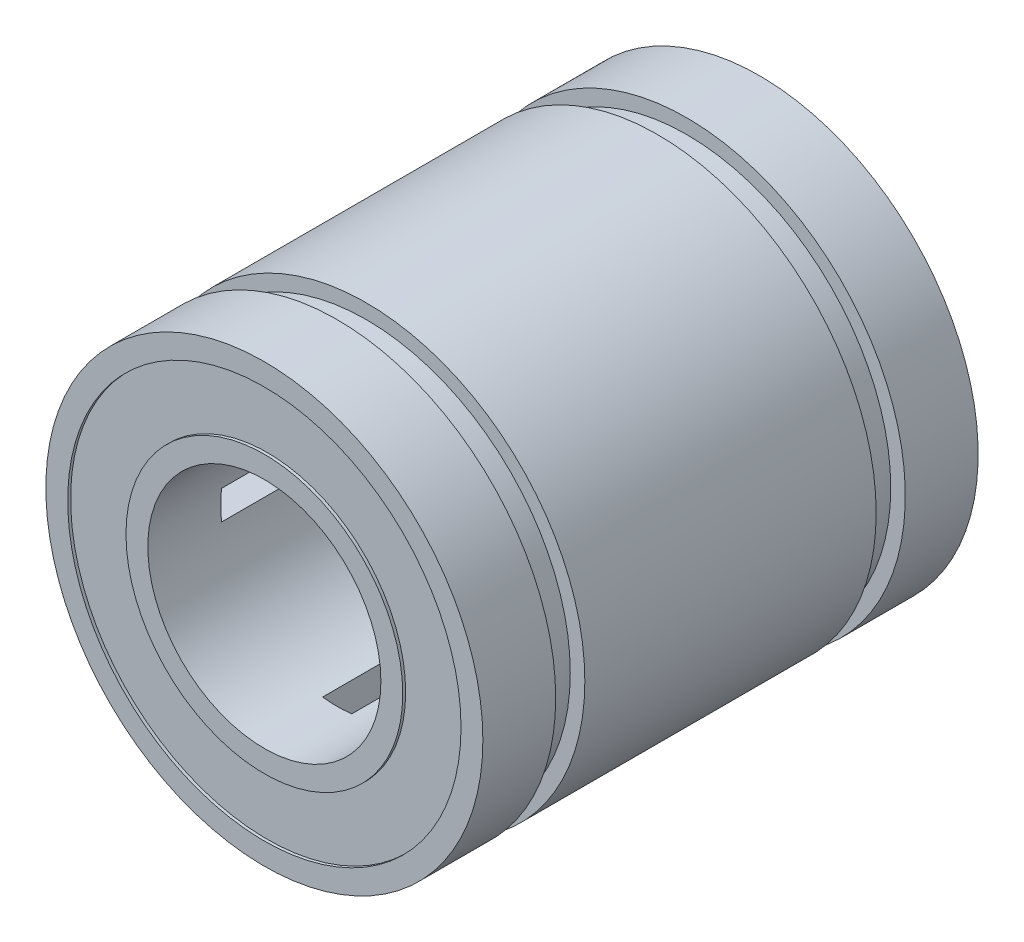
from build123d import *

# Parameters (mm, degrees)
SKETCH1_R           = 7.5
SKETCH1_R_2         = 4
BOSS_EXTRUDE1_DEPTH = 10
SKETCH2_R           = 7
BOSS_EXTRUDE2_DEPTH = 1
BOSS_EXTRUDE3_START = 1
SKETCH3_R           = 7
BOSS_EXTRUDE3_DEPTH = 1
BOSS_EXTRUDE4_START = 2.5
SKETCH5_R           = 7.5
BOSS_EXTRUDE4_DEPTH = 2.5
SKETCH10_W          = 1
SKETCH10_H          = 12
CUT_EXTRUDE4_DEPTH  = 10
SKETCH11_W          = 12
SKETCH11_H          = 1
CUT_EXTRUDE5_DEPTH  = 10
SKETCH6_R           = 7.5
BOSS_EXTRUDE6_DEPTH = 2.5
CUT_EXTRUDE1_START  = -17
SKETCH7_R           = 4
CUT_EXTRUDE1_DEPTH  = 17
SKETCH8_R           = 6.75
SKETCH8_R_2         = 4.75
CUT_EXTRUDE2_DEPTH  = 0.1
CUT_EXTRUDE3_START  = -0.1
SKETCH9_R           = 6.75
SKETCH9_R_2         = 4.75
CUT_EXTRUDE3_DEPTH  = 0.1


with BuildPart() as part:
    # Sketch1 → Boss-Extrude1 (new body)
    with BuildSketch(Plane.XY):
        Circle(SKETCH1_R)
        Circle(SKETCH1_R_2, mode=Mode.SUBTRACT)
    extrude(amount=BOSS_EXTRUDE1_DEPTH)

    # Sketch2 → Boss-Extrude2 (add)
    with BuildSketch(Plane.XY.offset(10)):
        Circle(SKETCH2_R)
    extrude(amount=BOSS_EXTRUDE2_DEPTH)

    # Sketch3 → Boss-Extrude3 (add)
    with BuildSketch(Plane(origin=(0, 0, 0), x_dir=(-1, 0, 0), z_dir=(0, 0, -1)).offset(BOSS_EXTRUDE3_START)):
        with Locations(Location((0, 0, 0), (0, 0, 180))):
            Circle(SKETCH3_R)
    extrude(amount=-BOSS_EXTRUDE3_DEPTH)

    # Sketch5 → Boss-Extrude4 (add)
    with BuildSketch(Plane(origin=(0, 0, -1), x_dir=(-1, 0, 0), z_dir=(0, 0, -1)).offset(BOSS_EXTRUDE4_START)):
        with Locations(Location((0, 0, 0), (0, 0, 180))):
            Circle(SKETCH5_R)
    extrude(amount=-BOSS_EXTRUDE4_DEPTH)

    # Sketch10 → Cut-Extrude4 (cut)
    with BuildSketch(Plane.XY.offset(11)):
        Rectangle(SKETCH10_W, SKETCH10_H)
    extrude(amount=-CUT_EXTRUDE4_DEPTH, mode=Mode.SUBTRACT)

    # Sketch11 → Cut-Extrude5 (cut)
    with BuildSketch(Plane.XY.offset(11)):
        Rectangle(SKETCH11_W, SKETCH11_H)
    extrude(amount=-CUT_EXTRUDE5_DEPTH, mode=Mode.SUBTRACT)

    # Sketch6 → Boss-Extrude6 (add)
    with BuildSketch(Plane.XY.offset(11)):
        Circle(SKETCH6_R)
    extrude(amount=BOSS_EXTRUDE6_DEPTH)

    # Sketch7 → Cut-Extrude1 (cut)
    with BuildSketch(Plane.XY.offset(13.5).offset(CUT_EXTRUDE1_START)):
        Circle(SKETCH7_R)
    extrude(amount=CUT_EXTRUDE1_DEPTH, mode=Mode.SUBTRACT)

    # Sketch8 → Cut-Extrude2 (cut)
    with BuildSketch(Plane.XY.offset(13.5)):
        Circle(SKETCH8_R)
        Circle(SKETCH8_R_2, mode=Mode.SUBTRACT)
    extrude(amount=-CUT_EXTRUDE2_DEPTH, mode=Mode.SUBTRACT)

    # Sketch9 → Cut-Extrude3 (cut)
    with BuildSketch(Plane(origin=(0, 0, -3.5), x_dir=(-1, 0, 0), z_dir=(0, 0, -1)).offset(CUT_EXTRUDE3_START)):
        with Locations(Location((0, 0, 0), (0, 0, 180))):
            Circle(SKETCH9_R)
        with Locations(Location((0, 0, 0), (0, 0, 180))):
            Circle(SKETCH9_R_2, mode=Mode.SUBTRACT)
    extrude(amount=CUT_EXTRUDE3_DEPTH, mode=Mode.SUBTRACT)


solid = part.part
